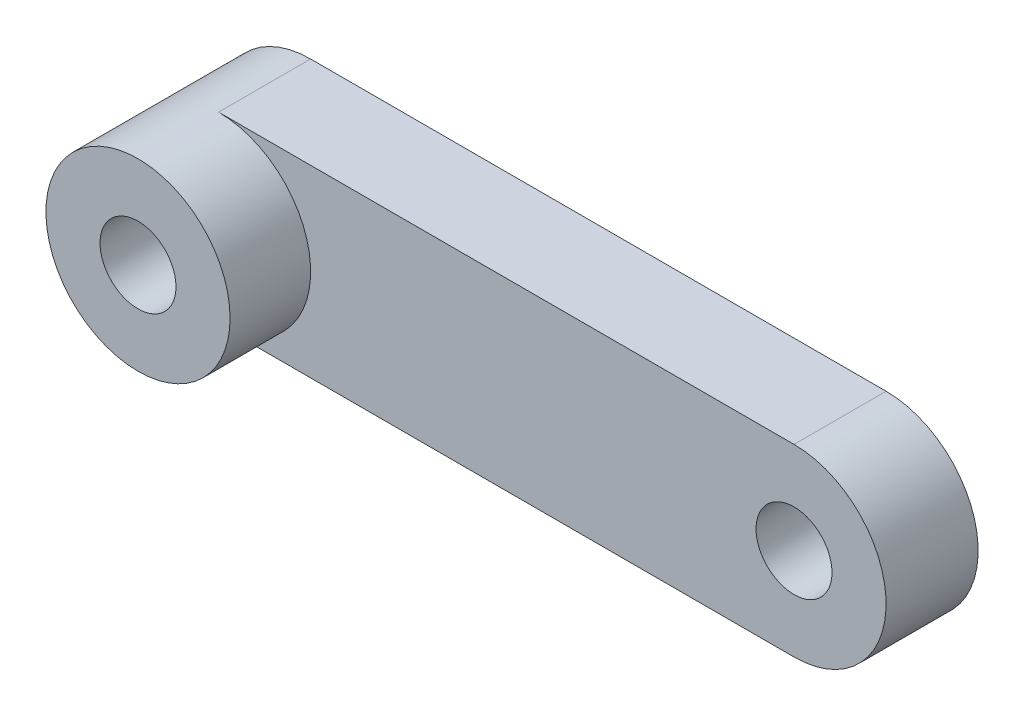
from build123d import *

# Parameters (mm, degrees)
SKETCH1_R           = 1.65
BOSS_EXTRUDE1_DEPTH = 4
SKETCH2_R           = 4
SKETCH2_R_2         = 1.65
BOSS_EXTRUDE2_DEPTH = 3.5


with BuildPart() as part:
    # Sketch1 → Boss-Extrude1 (new body)
    with BuildSketch(Plane.XY):
        with BuildLine():
            Line((-25, 4), (0, 4))
            ThreePointArc((0, 4), (4, 0), (0, -4))
            Line((0, -4), (-25, -4))
            ThreePointArc((-25, -4), (-29, 0), (-25, 4))
        make_face()
        Circle(SKETCH1_R, mode=Mode.SUBTRACT)
        with Locations((-25, 0)):
            Circle(SKETCH1_R, mode=Mode.SUBTRACT)
    extrude(amount=BOSS_EXTRUDE1_DEPTH)

    # Sketch2 → Boss-Extrude2 (add)
    with BuildSketch(Plane.XY.offset(4)):
        with Locations(Location((-25, 0, 0), (0, 0, 270))):
            Circle(SKETCH2_R)
        with Locations((-25, 0)):
            Circle(SKETCH2_R_2, mode=Mode.SUBTRACT)
    extrude(amount=BOSS_EXTRUDE2_DEPTH)


solid = part.part
